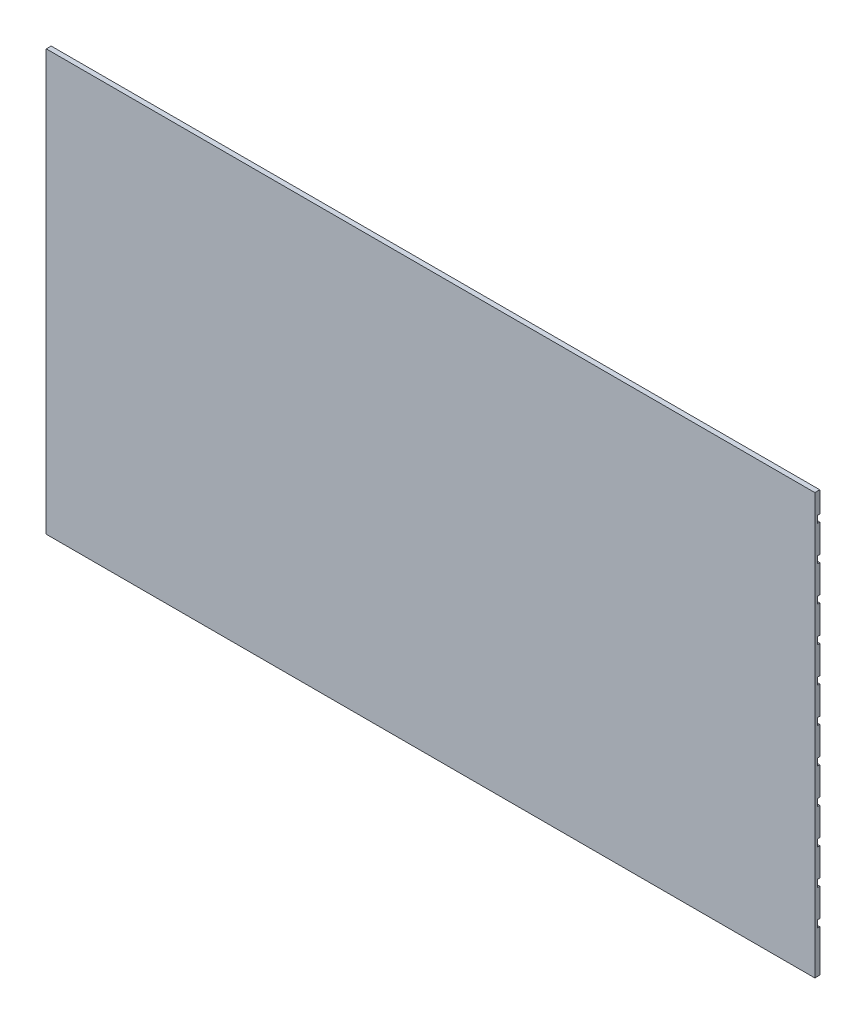
from build123d import *

# Parameters (mm, degrees)
SKETCH2_W           = 17.78
SKETCH2_H           = 1524
BOSS_EXTRUDE1_DEPTH = 2786.38
SKETCH3_W           = 2786.38
SKETCH3_H           = 25.4
CUT_EXTRUDE1_DEPTH  = 7.62


with BuildPart() as part:
    # Sketch2 → Boss-Extrude1 (new body)
    with BuildSketch(Plane(origin=(0, 0, 0), x_dir=(0, 0, -1), z_dir=(1, 0, 0))):
        with Locations((8.89, -762)):
            Rectangle(SKETCH2_W, SKETCH2_H)
    extrude(amount=BOSS_EXTRUDE1_DEPTH)

    # Sketch3 → Cut-Extrude1 (cut)
    with BuildSketch(Plane(origin=(0, 0, -17.78), x_dir=(-1, 0, 0), z_dir=(0, 0, -1))):
        with Locations((-1393.19, -88.9)):
            Rectangle(SKETCH3_W, SKETCH3_H)
        with Locations((-1393.19, -215.9)):
            Rectangle(SKETCH3_W, SKETCH3_H)
        with Locations((-1393.19, -342.9)):
            Rectangle(SKETCH3_W, SKETCH3_H)
        with Locations((-1393.19, -469.9)):
            Rectangle(SKETCH3_W, SKETCH3_H)
        with Locations((-1393.19, -596.9)):
            Rectangle(SKETCH3_W, SKETCH3_H)
        with Locations((-1393.19, -723.9)):
            Rectangle(SKETCH3_W, SKETCH3_H)
        with Locations((-1393.19, -850.9)):
            Rectangle(SKETCH3_W, SKETCH3_H)
        with Locations((-1393.19, -977.9)):
            Rectangle(SKETCH3_W, SKETCH3_H)
        with Locations((-1393.19, -1104.9)):
            Rectangle(SKETCH3_W, SKETCH3_H)
        with Locations((-1393.19, -1231.9)):
            Rectangle(SKETCH3_W, SKETCH3_H)
        with Locations((-1393.19, -1358.9)):
            Rectangle(SKETCH3_W, SKETCH3_H)
    extrude(amount=-CUT_EXTRUDE1_DEPTH, mode=Mode.SUBTRACT)


solid = part.part
